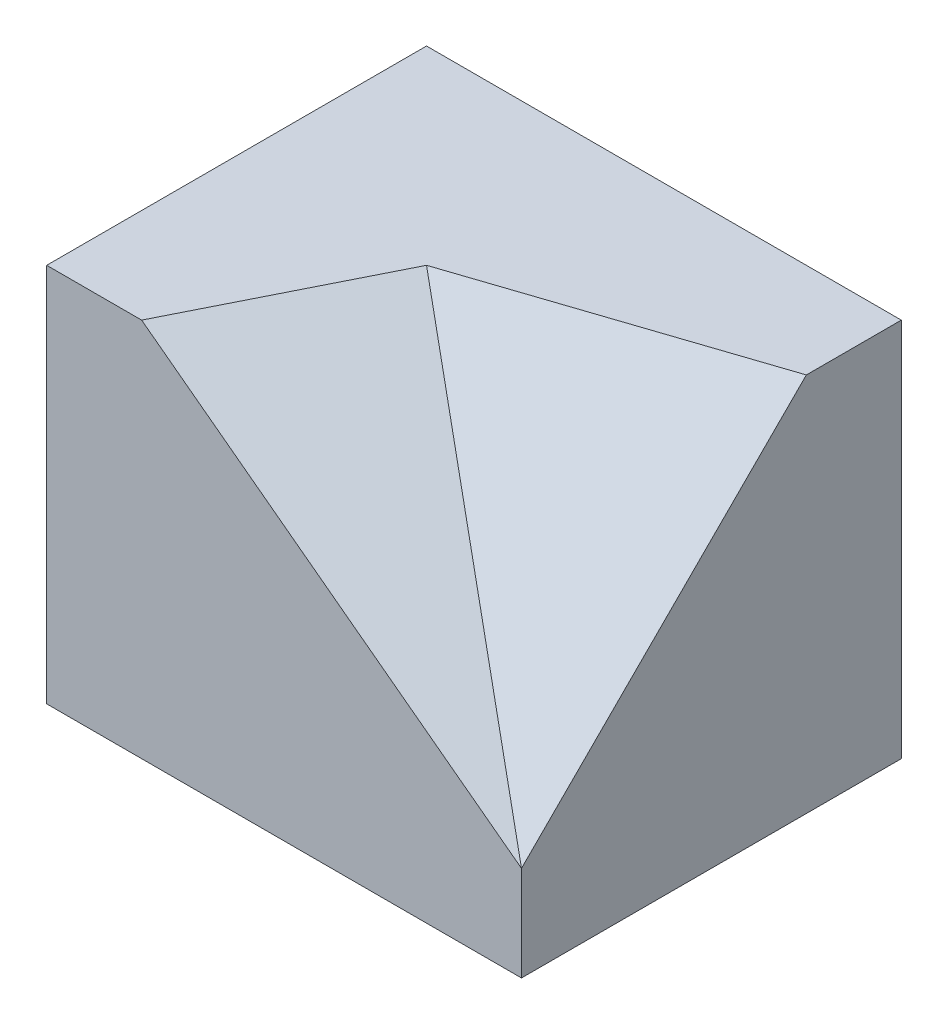
from build123d import *

# Parameters (mm, degrees)
SKETCH_1_W      = 50
SKETCH_1_H      = 40
EXTRUDE_1_DEPTH = 40


with BuildPart() as part:
    # 草圖1 → 填料-伸長1 (new body)
    with BuildSketch(Plane.XY):
        with Locations((-25, -20)):
            Rectangle(SKETCH_1_W, SKETCH_1_H)
    extrude(amount=EXTRUDE_1_DEPTH)

    # 草圖2 → 除料-疊層拉伸1 section 0
    with BuildSketch(Plane(origin=(0, 0, 0), x_dir=(1, 0, 0), z_dir=(0, 1, 0)), mode=Mode.PRIVATE) as loft_1_s0:
        with BuildLine():
            Line((0, -10), (-30, -20))
            Line((-30, -20), (0, -40))
            Line((0, -40), (0, -10))
        make_face()
    loft([Vertex(0, -30, 40), loft_1_s0.sketch], mode=Mode.SUBTRACT)

    # 草圖4 → 除料-疊層拉伸2 section 0
    with BuildSketch(Plane(origin=(0, 0, 0), x_dir=(1, 0, 0), z_dir=(0, 1, 0)), mode=Mode.PRIVATE) as loft_2_s0:
        with BuildLine():
            Line((-30, -20), (-40, -40))
            Line((-40, -40), (0, -40))
            Line((0, -40), (-30, -20))
        make_face()
    loft([loft_2_s0.sketch, Vertex(0, -30, 40)], mode=Mode.SUBTRACT)


solid = part.part
